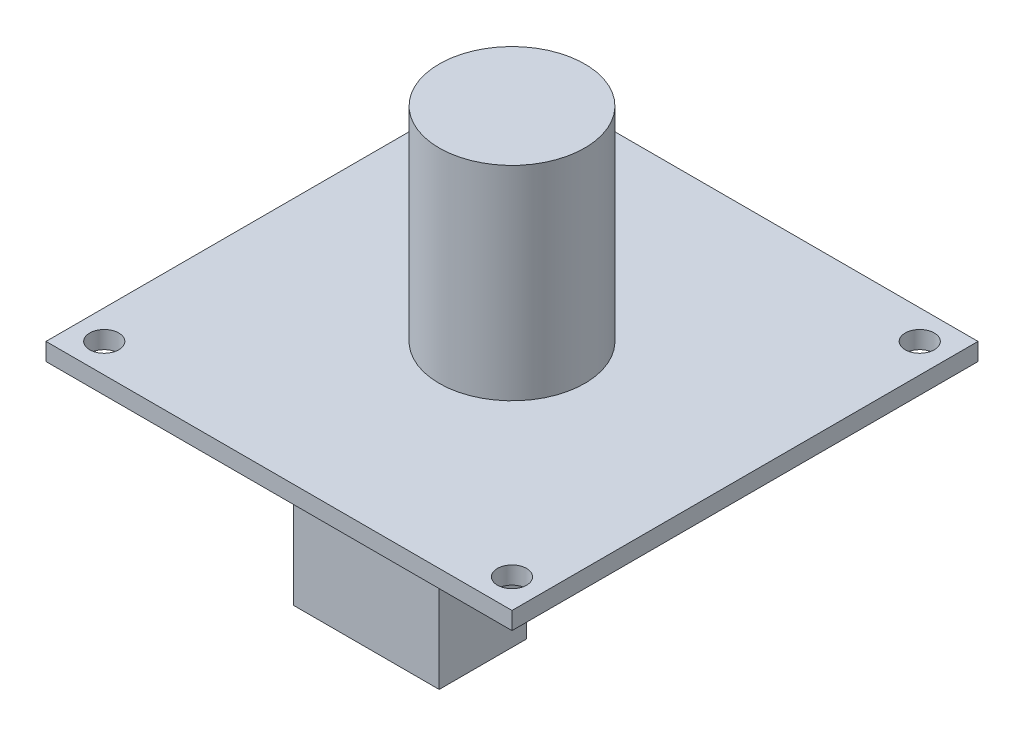
from build123d import *

# Parameters (mm, degrees)
SKETCH1_W           = 32
SKETCH1_H           = 32
SKETCH1_R           = 1
BOSS_EXTRUDE1_DEPTH = 1.2
SKETCH2_R           = 5
BOSS_EXTRUDE2_DEPTH = 14
SKETCH3_W           = 10
SKETCH3_H           = 6
BOSS_EXTRUDE3_DEPTH = 8


with BuildPart() as part:
    # Sketch1 → Boss-Extrude1 (new body)
    with BuildSketch(Plane(origin=(0, 0, 0), x_dir=(1, 0, 0), z_dir=(0, 1, 0))):
        Rectangle(SKETCH1_W, SKETCH1_H)
        with Locations(Location((-14, 14, 0), (0, 0, 270))):
            Circle(SKETCH1_R, mode=Mode.SUBTRACT)
        with Locations(Location((14, 14, 0), (0, 0, 270))):
            Circle(SKETCH1_R, mode=Mode.SUBTRACT)
        with Locations(Location((14, -14, 0), (0, 0, 270))):
            Circle(SKETCH1_R, mode=Mode.SUBTRACT)
        with Locations(Location((-14, -14, 0), (0, 0, 270))):
            Circle(SKETCH1_R, mode=Mode.SUBTRACT)
    extrude(amount=BOSS_EXTRUDE1_DEPTH)

    # Sketch2 → Boss-Extrude2 (add)
    with BuildSketch(Plane(origin=(0, 1.2, 0), x_dir=(1, 0, 0), z_dir=(0, 1, 0))):
        with Locations(Location((0, 0, 0), (0, 0, 270))):
            Circle(SKETCH2_R)
    extrude(amount=BOSS_EXTRUDE2_DEPTH)

    # Sketch3 → Boss-Extrude3 (add)
    with BuildSketch(Plane.XZ):
        with Locations((4, 11)):
            Rectangle(SKETCH3_W, SKETCH3_H)
    extrude(amount=BOSS_EXTRUDE3_DEPTH)


solid = part.part
